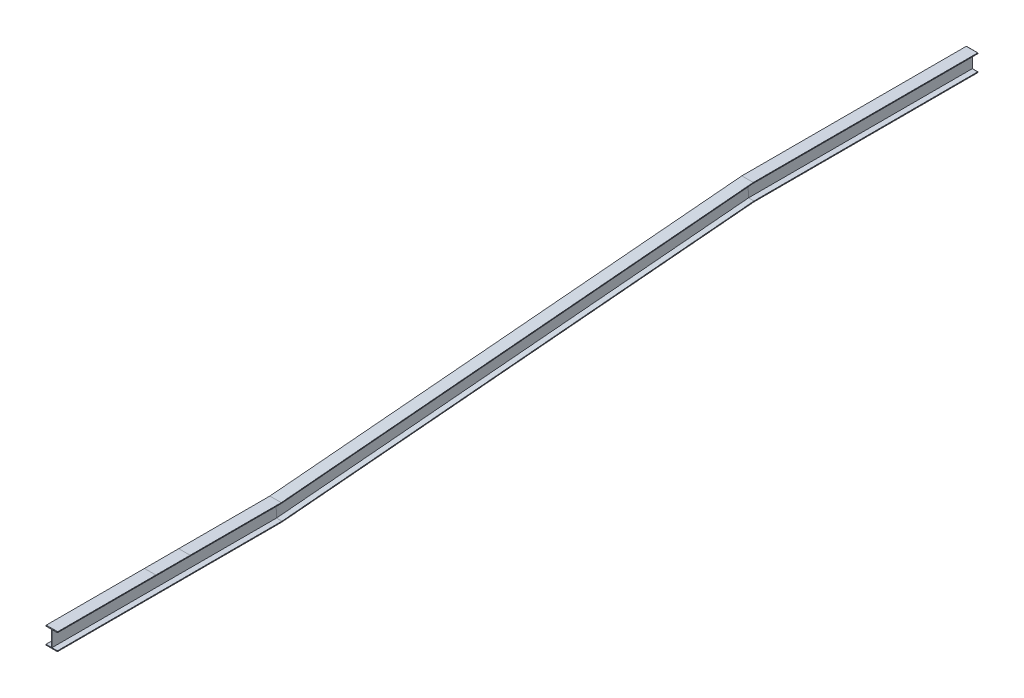
from build123d import *

# Parameters (mm, degrees)
BOSS_EXTRUDE1_DEPTH = 14.541598669
BOSS_EXTRUDE2_DEPTH = 11.109177684
BOSS_EXTRUDE5_DEPTH = 53.865447751
BOSS_EXTRUDE6_DEPTH = 51.790096061
FILLET2_R           = 3.175
SKETCH9_W           = 101.6
SKETCH9_H           = 1992.988096061
BOSS_EXTRUDE7_DEPTH = 0.188178657
FILLET3_R           = 3.175


with BuildPart() as part:
    # Sweep1: sweep along a path in Sketch2
    with BuildLine(Plane(origin=(0, 0, 0), x_dir=(0, 0, -1), z_dir=(1, 0, 0))) as sweep1_path:
        Line((0, -76.581240533), (1930, -76.581240533))
        Line((1930, -76.581240533), (6128.777671415, 290.764206382))
        Line((6128.777671415, 290.764206382), (8058.777671415, 290.764206382))
    # Sketch1 → Sweep1 (sweep)
    with BuildSketch(Plane.XY):
        Polygon((0, -0.000240533), (101.6, -0.000240533), (101.6, -7.112240533), (53.408035714, -7.112240533), (53.408035714, -146.050240533), (101.6, -146.050240533), (101.6, -153.162240533), (0, -153.162240533), (0, -146.050240533), (47.566035714, -146.050240533), (47.566035714, -7.112240533), (0, -7.112240533), align=None)
    sweep(path=sweep1_path.line, transition=Transition.RIGHT)

    # Sketch4 → Boss-Extrude1 (add)
    with BuildSketch(Plane(origin=(0, 0, -8058.777671415), x_dir=(-1, 0, 0), z_dir=(0, 0, -1))):
        Polygon((0, 360.233206382), (0, 367.345206382), (-101.6, 367.345206382), (-101.6, 360.233206382), (-53.408035714, 360.233206382), (-53.408035714, 221.295206382), (-101.6, 221.295206382), (-101.6, 214.183206382), (0, 214.183206382), (0, 221.295206382), (-47.566035714, 221.295206382), (-47.566035714, 360.233206382), align=None)
    extrude(amount=BOSS_EXTRUDE1_DEPTH)

    # Sketch5 → Boss-Extrude2 (add)
    with BuildSketch(Plane.XY):
        Polygon((0, -0.000240533), (0, -7.112240533), (47.566035714, -7.112240533), (47.566035714, -146.050240533), (0, -146.050240533), (0, -153.162240533), (101.6, -153.162240533), (101.6, -146.050240533), (53.408035714, -146.050240533), (53.408035714, -7.112240533), (101.6, -7.112240533), (101.6, -0.000240533), align=None)
    extrude(amount=BOSS_EXTRUDE2_DEPTH)

    # Sketch7 → Boss-Extrude5 (add)
    with BuildSketch(Plane.XY.offset(11.109177684)):
        Polygon((101.6, -7.112240533), (101.6, -0.000240533), (0, -0.000240533), (0, -7.112240533), (47.566035714, -7.112240533), (47.566035714, -146.050240533), (0, -146.050240533), (0, -153.162240533), (101.6, -153.162240533), (101.6, -146.050240533), (53.408035714, -146.050240533), (53.408035714, -7.112240533), align=None)
    extrude(amount=BOSS_EXTRUDE5_DEPTH)

    # Sketch8 → Boss-Extrude6 (add)
    with BuildSketch(Plane(origin=(0, 0, -8073.319270083), x_dir=(-1, 0, 0), z_dir=(0, 0, -1))):
        Polygon((-47.566035714, 221.295206382), (-47.566035714, 360.233206382), (0, 360.233206382), (0, 367.345206382), (-101.6, 367.345206382), (-101.6, 360.233206382), (-53.408035714, 360.233206382), (-53.408035714, 221.295206382), (-101.6, 221.295206382), (-101.6, 214.183206382), (0, 214.183206382), (0, 221.295206382), align=None)
    extrude(amount=BOSS_EXTRUDE6_DEPTH)

    # Fillet2
    fillet2_edges = [part.edges().sort_by_distance(p)[0] for p in [
        (50.8, -0.000240533, 64.974625435),
        (50.8, 367.345206382, -8125.109366144),
    ]]
    fillet(fillet2_edges, radius=FILLET2_R)

    # Sketch9 → Boss-Extrude7 (add)
    with BuildSketch(Plane.XZ.offset(-214.183206382)):
        with Locations((50.8, -7128.615318114)):
            Rectangle(SKETCH9_W, SKETCH9_H)
    extrude(amount=BOSS_EXTRUDE7_DEPTH)

    # Fillet3
    fillet3_edges = [part.edges().sort_by_distance(p)[0] for p in [
        (23.783017857, 221.295206382, -8125.109366144),
        (77.504017857, 221.295206382, -8125.109366144),
    ]]
    fillet(fillet3_edges, radius=FILLET3_R)


solid = part.part
